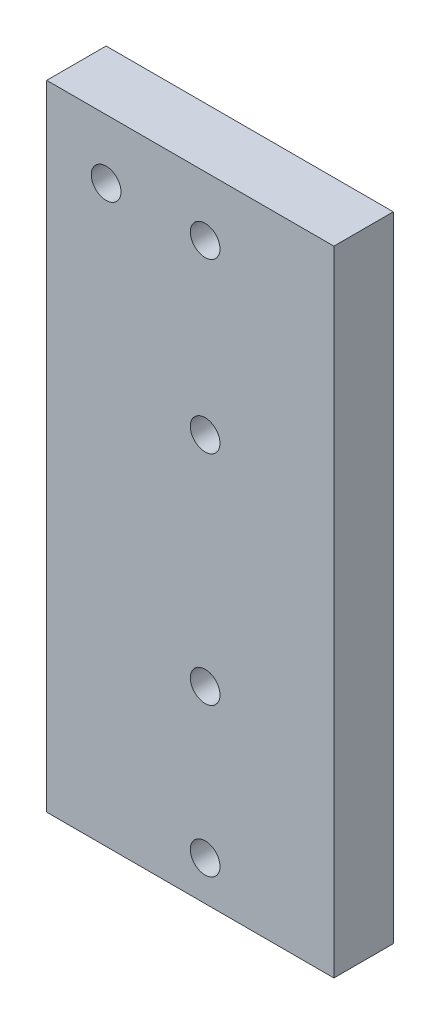
from build123d import *

# Parameters (mm, degrees)
SKETCH_1_W      = 145
SKETCH_1_H      = 320
SKETCH_1_R      = 7.5
EXTRUDE_1_DEPTH = 30


with BuildPart() as part:
    # 草图1 → 凸台-拉伸1 (new body)
    with BuildSketch(Plane.XY):
        Rectangle(SKETCH_1_W, SKETCH_1_H)
        with Locations((7.5, 130)):
            Circle(SKETCH_1_R, mode=Mode.SUBTRACT)
        with Locations((-42.5, 130)):
            Circle(SKETCH_1_R, mode=Mode.SUBTRACT)
        with Locations((7.5, -140)):
            Circle(SKETCH_1_R, mode=Mode.SUBTRACT)
        with Locations((7.5, 45)):
            Circle(SKETCH_1_R, mode=Mode.SUBTRACT)
        with Locations((7.5, -65)):
            Circle(SKETCH_1_R, mode=Mode.SUBTRACT)
    extrude(amount=EXTRUDE_1_DEPTH)


solid = part.part
